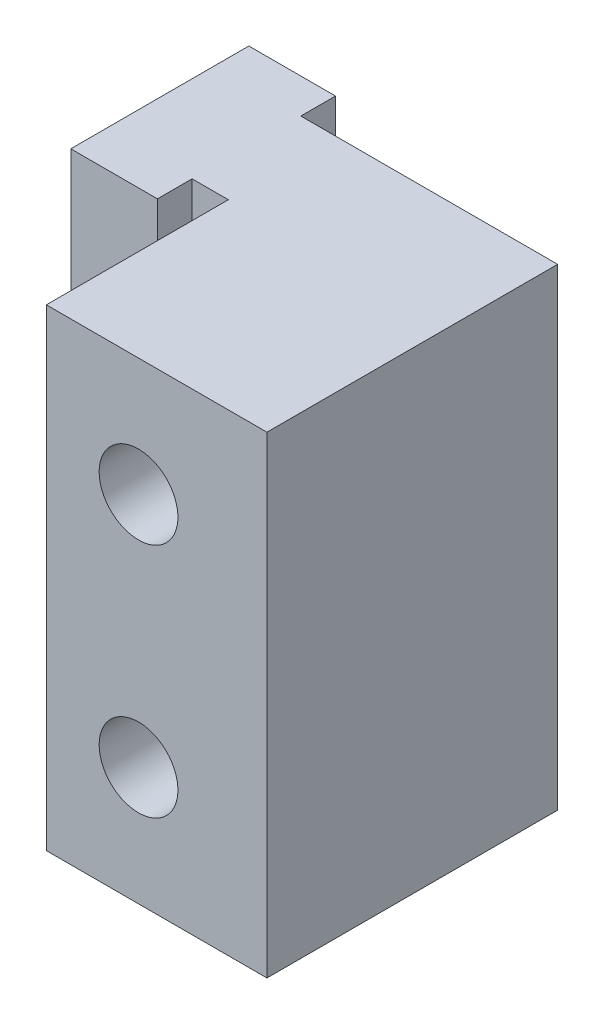
from build123d import *

# Parameters (mm, degrees)
SKETCH1_W           = 2.75
SKETCH1_H           = 5.65
SKETCH1_W_2         = 1.15
SKETCH1_H_2         = 1.725
BOSS_EXTRUDE1_DEPTH = 15
SKETCH2_R           = 1.25
CUT_EXTRUDE1_DEPTH  = 21.710157532


with BuildPart() as part:
    # Sketch1 → Boss-Extrude1 (new body)
    with BuildSketch(Plane(origin=(0, 0, 0), x_dir=(1, 0, 0), z_dir=(0, 1, 0))):
        with Locations((1.375, 2.825)):
            Rectangle(SKETCH1_W, SKETCH1_H)
        with Locations((3.325, 3.6875)):
            Rectangle(SKETCH1_W_2, SKETCH1_H_2)
        with Locations((3.325, 1.9625)):
            Rectangle(SKETCH1_W_2, SKETCH1_H_2)
        Polygon((10.9, -4.675), (10.9, 4.55), (3.9, 4.55), (3.9, 2.825), (3.9, -4.675), align=None)
    extrude(amount=BOSS_EXTRUDE1_DEPTH)

    # Sketch2 → Cut-Extrude1 (cut, through all)
    with BuildSketch(Plane(origin=(0, 0, -4.55), x_dir=(-1, 0, 0), z_dir=(0, 0, -1))):
        with Locations((-6.825, 11.25)):
            Circle(SKETCH2_R)
        with Locations((-6.825, 3.75)):
            Circle(SKETCH2_R)
    extrude(amount=-CUT_EXTRUDE1_DEPTH, mode=Mode.SUBTRACT)


solid = part.part
